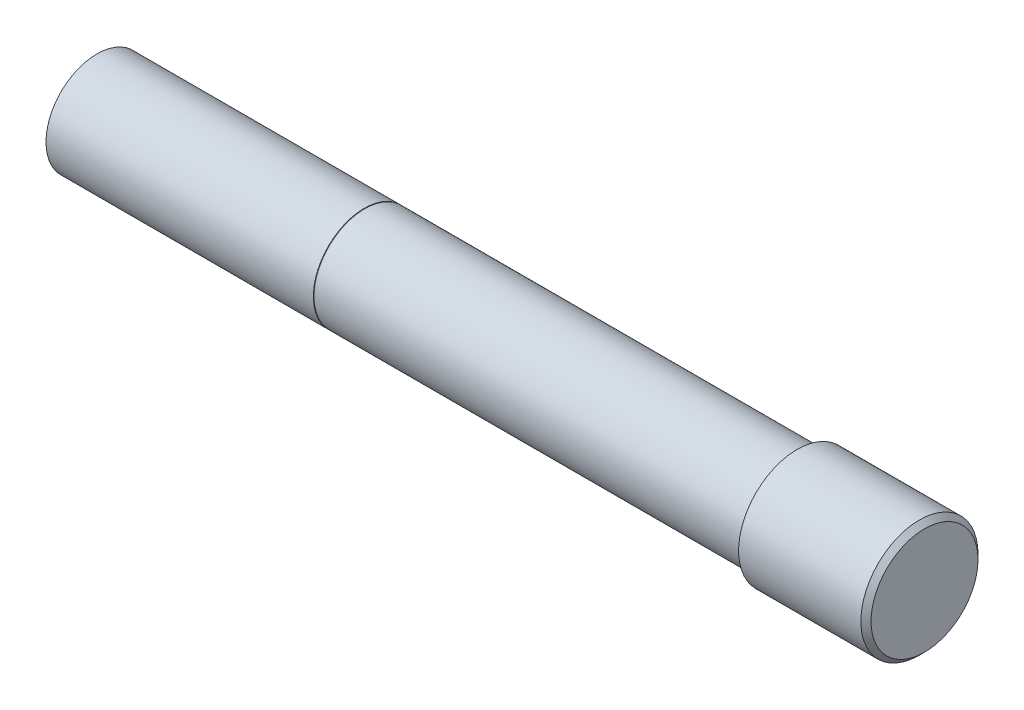
from build123d import *

# Parameters (mm, degrees)
CHANFRO1_SIZE         = 0.2
ESBO_O5_R             = 2.627342907
CORTE_EXTRUS_O1_DEPTH = 0.5


with BuildPart() as part:
    # Esboço1 → Revolução1 (revolve)
    with BuildSketch(Plane(origin=(0, 0, 0), x_dir=(1, 0, 0), z_dir=(0, 1, 0))):
        Polygon((0, 0), (33, 0), (33, 2.3), (28, 2.3), (28, 2), (11.029645727, 2), (11.029645727, 1.981975223), (11, 1.981975223), (11, 2), (0, 2), align=None)
    revolve(axis=Axis((0, 0, 0), (-1, 0, 0)))

    # Chanfro1
    chanfro1_edges = [part.edges().sort_by_distance(p)[0] for p in [
        (33, 0, 2.3),
    ]]
    chamfer(chanfro1_edges, length=CHANFRO1_SIZE)

    # Esboço5 → Corte-extrusão1 (cut)
    with BuildSketch(Plane.ZY):
        Circle(ESBO_O5_R)
    extrude(amount=-CORTE_EXTRUS_O1_DEPTH, mode=Mode.SUBTRACT)


solid = part.part
